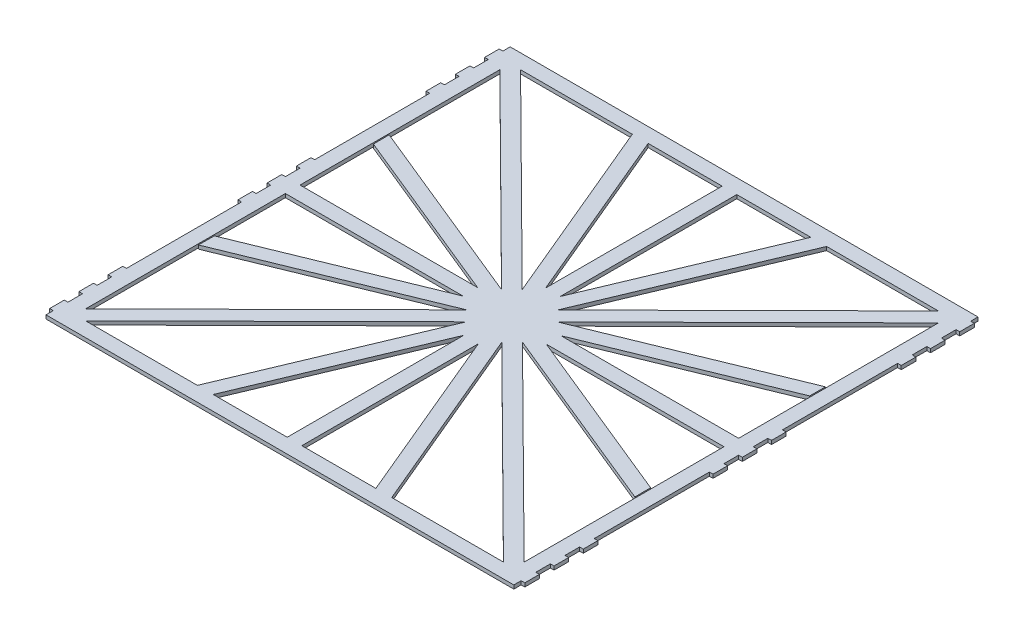
from build123d import *

# Parameters (mm, degrees)
SKETCH1_W               = 412.75
SKETCH1_H               = 403.225
BOSS_EXTRUDE1_DEPTH     = 3.175
SKETCH2_W               = 3.175
SKETCH2_H               = 87.3125
CUT_EXTRUDE1_DEPTH      = 3.175
SKETCH3_W               = 3.175
SKETCH3_H               = 12.7
CUT_EXTRUDE2_DEPTH      = 3.175
SKETCH4_W               = 3.175
SKETCH4_H               = 12.7
CUT_EXTRUDE3_DEPTH      = 3.175
MIRROR2_COPY_1_SKETCH_W = 3.175
MIRROR2_COPY_1_SKETCH_H = 12.7
MIRROR2_COPY_1_DEPTH    = 3.175
CUT_EXTRUDE4_DEPTH      = 3.175
MIRROR4_COPY_1_DEPTH    = 3.175


with BuildPart() as part:
    # Sketch1 → Boss-Extrude1 (new body)
    with BuildSketch(Plane(origin=(0, 0, 0), x_dir=(1, 0, 0), z_dir=(0, 1, 0))):
        Rectangle(SKETCH1_W, SKETCH1_H)
    extrude(amount=BOSS_EXTRUDE1_DEPTH)

    # Sketch2 → Cut-Extrude1 (cut)
    with BuildSketch(Plane(origin=(0, 3.175, 0), x_dir=(1, 0, 0), z_dir=(0, 1, 0))):
        with Locations((-204.7875, 81.75625)):
            Rectangle(SKETCH2_W, SKETCH2_H)
        with Locations((-204.7875, -81.75625)):
            Rectangle(SKETCH2_W, SKETCH2_H)
    cut_extrude1 = extrude(amount=-CUT_EXTRUDE1_DEPTH, mode=Mode.SUBTRACT)

    # Sketch3 → Cut-Extrude2 (cut)
    with BuildSketch(Plane(origin=(0, 3.175, 0), x_dir=(1, 0, 0), z_dir=(0, 1, 0))):
        with Locations((-204.7875, 201.6125)):
            Rectangle(SKETCH3_W, SKETCH3_H)
        with Locations((-204.7875, 176.2125)):
            Rectangle(SKETCH3_W, SKETCH3_H)
        with Locations((-204.7875, 150.8125)):
            Rectangle(SKETCH3_W, SKETCH3_H)
        with Locations((-204.7875, 125.4125)):
            Rectangle(SKETCH3_W, SKETCH3_H)
    cut_extrude2 = extrude(amount=-CUT_EXTRUDE2_DEPTH, mode=Mode.SUBTRACT)

    # Sketch4 → Cut-Extrude3 (cut)
    with BuildSketch(Plane(origin=(0, 3.175, 0), x_dir=(1, 0, 0), z_dir=(0, 1, 0))):
        with Locations((-204.7875, 38.1)):
            Rectangle(SKETCH4_W, SKETCH4_H)
        with Locations((-204.7875, 12.7)):
            Rectangle(SKETCH4_W, SKETCH4_H)
        with Locations((-204.7875, -12.7)):
            Rectangle(SKETCH4_W, SKETCH4_H)
        with Locations((-204.7875, -38.1)):
            Rectangle(SKETCH4_W, SKETCH4_H)
    cut_extrude3 = extrude(amount=-CUT_EXTRUDE3_DEPTH, mode=Mode.SUBTRACT)

    # Mirror1: Cut-Extrude2 across plane
    add(cut_extrude2.mirror(Plane.XY), mode=Mode.SUBTRACT)

    # Mirror2: Cut-Extrude1, Cut-Extrude2, Cut-Extrude3 across plane
    add(cut_extrude1.mirror(Plane(origin=(0, 0, 0), x_dir=(0, 0, 1), z_dir=(1, 0, 0))), mode=Mode.SUBTRACT)
    add(cut_extrude2.mirror(Plane(origin=(0, 0, 0), x_dir=(0, 0, 1), z_dir=(1, 0, 0))), mode=Mode.SUBTRACT)
    add(cut_extrude3.mirror(Plane(origin=(0, 0, 0), x_dir=(0, 0, 1), z_dir=(1, 0, 0))), mode=Mode.SUBTRACT)

    # Mirror2 copy 1 sketch → Mirror2 copy 1 (cut)
    with BuildSketch(Plane(origin=(0, 3.175, 0), x_dir=(-1, 0, 0), z_dir=(0, 1, 0))):
        with Locations((-204.7875, 201.6125)):
            Rectangle(MIRROR2_COPY_1_SKETCH_W, MIRROR2_COPY_1_SKETCH_H)
        with Locations((-204.7875, 176.2125)):
            Rectangle(MIRROR2_COPY_1_SKETCH_W, MIRROR2_COPY_1_SKETCH_H)
        with Locations((-204.7875, 150.8125)):
            Rectangle(MIRROR2_COPY_1_SKETCH_W, MIRROR2_COPY_1_SKETCH_H)
        with Locations((-204.7875, 125.4125)):
            Rectangle(MIRROR2_COPY_1_SKETCH_W, MIRROR2_COPY_1_SKETCH_H)
    extrude(amount=-MIRROR2_COPY_1_DEPTH, mode=Mode.SUBTRACT)

    # Sketch5 → Cut-Extrude4 (cut)
    with BuildSketch(Plane(origin=(0, 3.175, 0), x_dir=(1, 0, 0), z_dir=(0, 1, 0))):
        Polygon((-190.5, 6.35), (-36.183770369, 6.35), (-189.462331729, 69.064060773), (-189.581560693, 82.834747968), (-24.310343952, 15.213881497), (-190.5, 179.970868096), align=None)
        Polygon((-181.480614775, 188.9125), (-15.369047179, 24.232928676), (-84.41827204, 188.9125), align=None)
        Polygon((-70.647068702, 188.9125), (-6.35, 35.566626349), (-6.35, 188.9125), align=None)
    cut_extrude4 = extrude(amount=-CUT_EXTRUDE4_DEPTH, mode=Mode.SUBTRACT)

    # Mirror3: Cut-Extrude4 across plane
    add(cut_extrude4.mirror(Plane(origin=(0, 0, 0), x_dir=(0, 0, 1), z_dir=(1, 0, 0))), mode=Mode.SUBTRACT)

    # Mirror4: Cut-Extrude4 across plane
    add(cut_extrude4.mirror(Plane.XY), mode=Mode.SUBTRACT)

    # Mirror4 copy 1 sketch → Mirror4 copy 1 (cut)
    with BuildSketch(Plane(origin=(0, 3.175, 0), x_dir=(-1, 0, 0), z_dir=(0, 1, 0))):
        Polygon((-190.5, 6.35), (-36.183770369, 6.35), (-189.462331729, 69.064060773), (-189.581560693, 82.834747968), (-24.310343952, 15.213881497), (-190.5, 179.970868096), align=None)
        Polygon((-181.480614775, 188.9125), (-15.369047179, 24.232928676), (-84.41827204, 188.9125), align=None)
        Polygon((-70.647068702, 188.9125), (-6.35, 35.566626349), (-6.35, 188.9125), align=None)
    extrude(amount=-MIRROR4_COPY_1_DEPTH, mode=Mode.SUBTRACT)


solid = part.part
